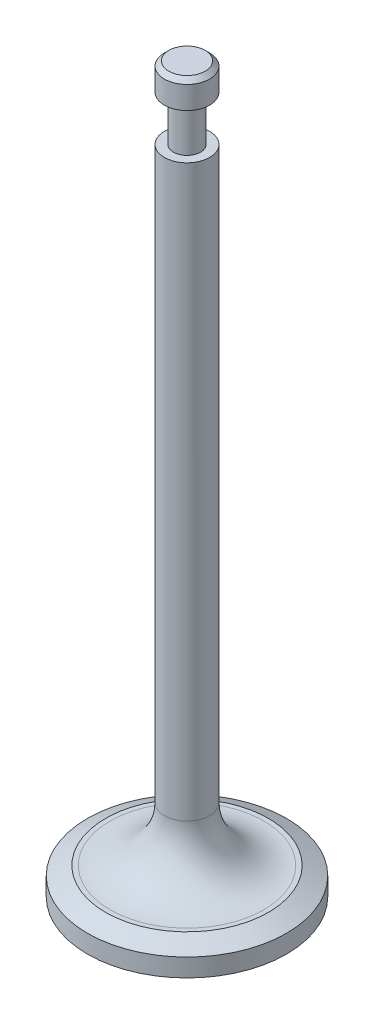
from build123d import *

# Parameters (mm, degrees)
FILLET1_R      = 6
CHAMFER1_SIZE  = 0.5
CHAMFER2_SIZE  = 2
CHAMFER2_SIZE2 = 1


with BuildPart() as part:
    # Sketch2 → Revolve1 (revolve)
    with BuildSketch(Plane.XY, mode=Mode.PRIVATE) as revolve1_sk:
        Polygon((0, 0), (0, 80), (2.5, 80), (2.5, 77), (1.5, 77), (1.5, 72), (2.5, 72), (2.5, 3), (11, 3), (11, 0), align=None)
    revolve(revolve1_sk.sketch.rotate(Axis((0, 0, 0), (0, 1, 0)), 90), axis=Axis((0, 0, 0), (0, 1, 0)))

    # Fillet1
    fillet1_edges = [part.edges().sort_by_distance(p)[0] for p in [
        (0, 3, 2.5),
    ]]
    fillet(fillet1_edges, radius=FILLET1_R)

    # Chamfer1
    chamfer1_edges = [part.edges().sort_by_distance(p)[0] for p in [
        (0, 80, 2.5),
    ]]
    chamfer(chamfer1_edges, length=CHAMFER1_SIZE)

    # Chamfer2
    chamfer2_edges = [part.edges().sort_by_distance(p)[0] for p in [
        (0, 3, 11),
    ]]
    chamfer2_side = [part.faces().sort_by_distance(p)[0] for p in [
        (0, 3, 8.811126984),
    ]]
    chamfer(chamfer2_edges, length=CHAMFER2_SIZE, length2=CHAMFER2_SIZE2, reference=chamfer2_side[0])


solid = part.part
